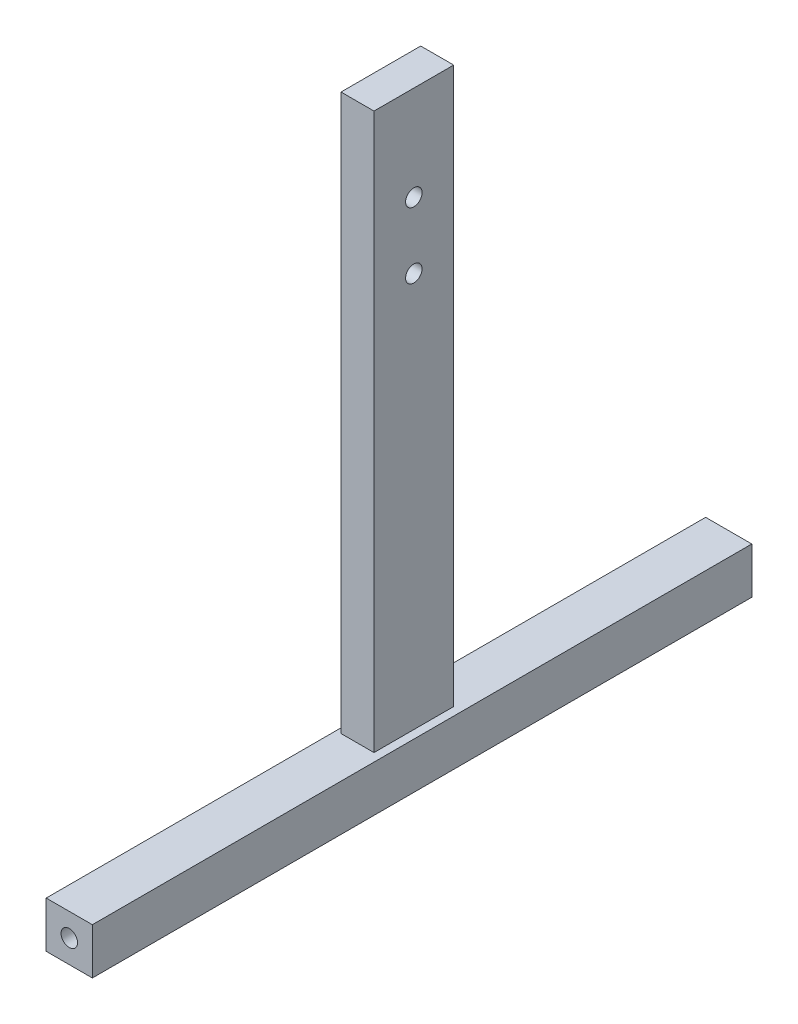
from build123d import *

# Parameters (mm, degrees)
SKETCH1_W           = 35.56
SKETCH1_H           = 35.56
BOSS_EXTRUDE1_DEPTH = 508
SKETCH2_R           = 6.35
CUT_EXTRUDE1_DEPTH  = 509.621919307
SKETCH3_W           = 25.4
SKETCH3_H           = 61.394695038
BOSS_EXTRUDE2_DEPTH = 427.99
SKETCH4_R           = 6.35
CUT_EXTRUDE2_DEPTH  = 677.596597242


with BuildPart() as part:
    # Sketch1 → Boss-Extrude1 (new body)
    with BuildSketch(Plane.XY):
        Rectangle(SKETCH1_W, SKETCH1_H)
    extrude(amount=BOSS_EXTRUDE1_DEPTH)

    # Sketch2 → Cut-Extrude1 (cut, through all)
    with BuildSketch(Plane.XY.offset(508)):
        Circle(SKETCH2_R)
    extrude(amount=-CUT_EXTRUDE1_DEPTH, mode=Mode.SUBTRACT)


with BuildPart() as body_2:
    # Sketch3 → Boss-Extrude2 (new body)
    with BuildSketch(Plane(origin=(0, 17.78, 0), x_dir=(1, 0, 0), z_dir=(0, 1, 0))):
        with Locations((-1.27, -254)):
            Rectangle(SKETCH3_W, SKETCH3_H)
    extrude(amount=BOSS_EXTRUDE2_DEPTH)

    # Sketch4 → Cut-Extrude2 (cut, through all)
    with BuildSketch(Plane.ZY.offset(13.97)):
        with Locations((254, 372.872)):
            Circle(SKETCH4_R)
        with Locations((254, 322.072)):
            Circle(SKETCH4_R)
    extrude(amount=-CUT_EXTRUDE2_DEPTH, mode=Mode.SUBTRACT)


solid = Compound([part.part, body_2.part])
